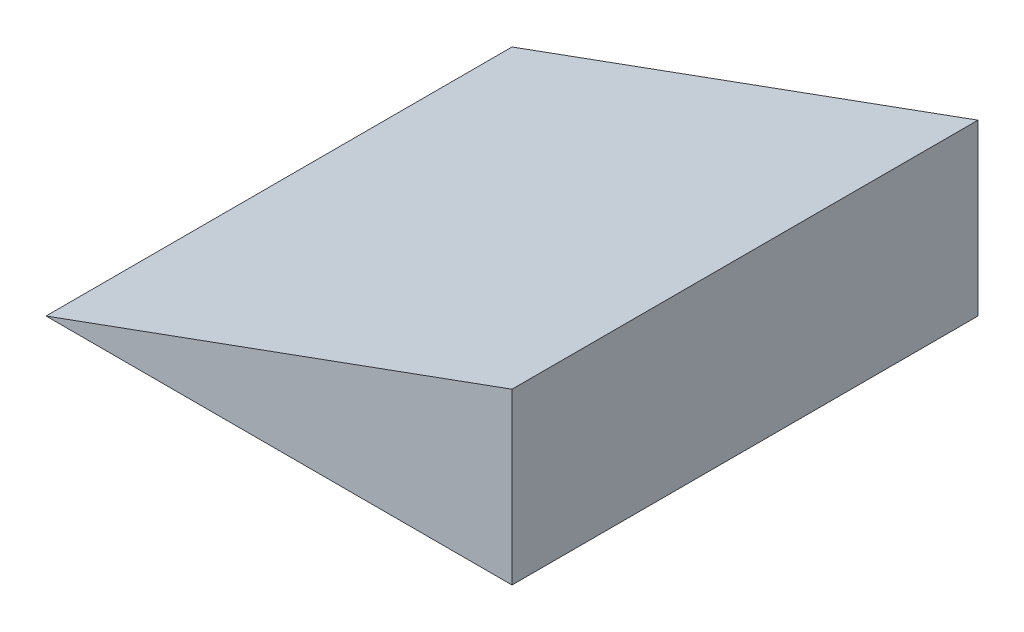
from build123d import *

# Parameters (mm, degrees)
BOSS_EXTRUDE1_DEPTH = 4000


with BuildPart() as part:
    # Sketch1 → Boss-Extrude1 (new body)
    with BuildSketch(Plane.XY):
        Polygon((-2000, 0), (2000, 0), (2000, 1455.880937065), align=None)
    extrude(amount=BOSS_EXTRUDE1_DEPTH)


solid = part.part
